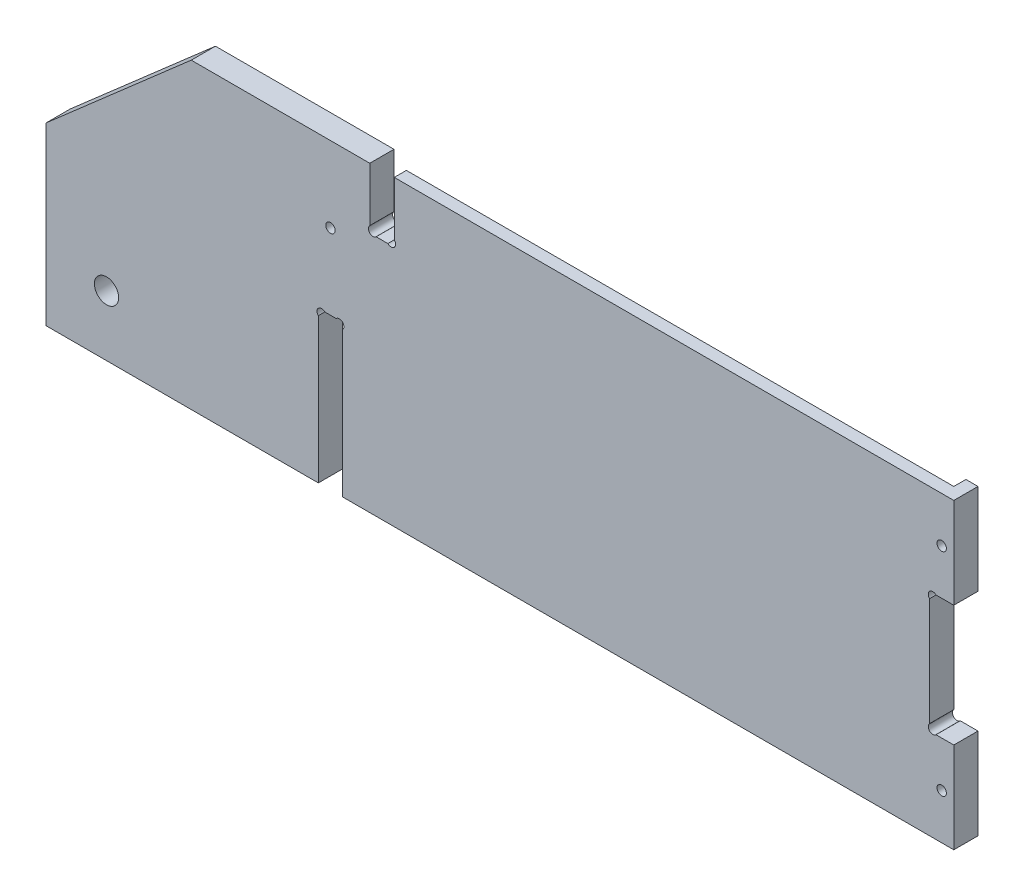
from build123d import *

# Parameters (mm, degrees)
ESQUISSE1_R             = 1.55
BOSS_EXTRU_1_DEPTH      = 8
ENL_V_MAT_EXTRU_1_DEPTH = 4
ESQUISSE3_R             = 4
ENL_V_MAT_EXTRU_2_DEPTH = 38


with BuildPart() as part:
    # Esquisse1 → Boss.-Extru.1 (new body)
    with BuildSketch(Plane.XY):
        with BuildLine():
            Line((-2.034299831, 64.480985332), (56.965700169, 64.480985332))
            Line((56.965700169, 64.480985332), (56.965700169, 46.626034607))
            ThreePointArc((56.965700169, 46.626034607), (56.941837013, 44.504848488), (59.063023131, 44.480985332))
            Line((59.063023131, 44.480985332), (62.935403121, 44.480985332))
            ThreePointArc((62.935403121, 44.480985332), (65.056723464, 44.480985332), (65.056723464, 46.602305676))
            Line((65.056723464, 46.602305676), (65.056723464, 64.480985332))
            Line((65.056723464, 64.480985332), (249.965700169, 64.480985332))
            Line((249.965700169, 64.480985332), (249.965700169, 34.480985332))
            Line((249.965700169, 34.480985332), (244.087020512, 34.480985332))
            ThreePointArc((244.087020512, 34.480985332), (241.965700169, 34.480985332), (241.965700169, 32.359664989))
            Line((241.965700169, 32.359664989), (241.965700169, -3.397694324))
            ThreePointArc((241.965700169, -3.397694324), (241.965700169, -5.519014668), (244.087020512, -5.519014668))
            Line((244.087020512, -5.519014668), (249.965700169, -5.519014668))
            Line((249.965700169, -5.519014668), (249.965700169, -35.519014668))
            Line((249.965700169, -35.519014668), (47.965700169, -35.519014668))
            Line((47.965700169, -35.519014668), (47.965700169, 12.359664989))
            ThreePointArc((47.965700169, 12.359664989), (47.965700169, 14.480985332), (45.844379825, 14.480985332))
            Line((45.844379825, 14.480985332), (42.087020512, 14.480985332))
            ThreePointArc((42.087020512, 14.480985332), (39.965700169, 14.480985332), (39.965700169, 12.359664989))
            Line((39.965700169, 12.359664989), (39.965700169, -35.519014668))
            Line((39.965700169, -35.519014668), (-50.034299831, -35.519014668))
            Line((-50.034299831, -35.519014668), (-50.034299831, 22.512874652))
            Line((-50.034299831, 22.512874652), (-2.034299831, 64.480985332))
        make_face()
        with Locations((245.965700169, 49.480985332)):
            Circle(ESQUISSE1_R, mode=Mode.SUBTRACT)
        with Locations((245.965700169, -20.519014668)):
            Circle(ESQUISSE1_R, mode=Mode.SUBTRACT)
        with Locations((43.965700169, 39.480985332)):
            Circle(ESQUISSE1_R, mode=Mode.SUBTRACT)
    extrude(amount=BOSS_EXTRU_1_DEPTH)

    # Esquisse2 → Enlèv. mat.-Extru.1 (cut)
    with BuildSketch(Plane(origin=(0, 0, 0), x_dir=(-1, 0, 0), z_dir=(0, 0, -1))):
        with BuildLine():
            Line((-245.965700169, 64.480985332), (-60.965700169, 64.480985332))
            Line((-60.965700169, 64.480985332), (-60.965700169, 52.480985332))
            Line((-60.965700169, 52.480985332), (-243.844379825, 52.480985332))
            ThreePointArc((-243.844379825, 52.480985332), (-245.965700169, 52.480985332), (-245.965700169, 54.602305676))
            Line((-245.965700169, 54.602305676), (-245.965700169, 64.480985332))
        make_face()
    extrude(amount=-ENL_V_MAT_EXTRU_1_DEPTH, mode=Mode.SUBTRACT)

    # Esquisse3 → Enlèv. mat.-Extru.2 (cut)
    with BuildSketch(Plane(origin=(0, 0, 0), x_dir=(-1, 0, 0), z_dir=(0, 0, -1))):
        with Locations((30.034299831, -15.519014668)):
            Circle(ESQUISSE3_R)
    extrude(amount=-ENL_V_MAT_EXTRU_2_DEPTH, mode=Mode.SUBTRACT)


solid = part.part
